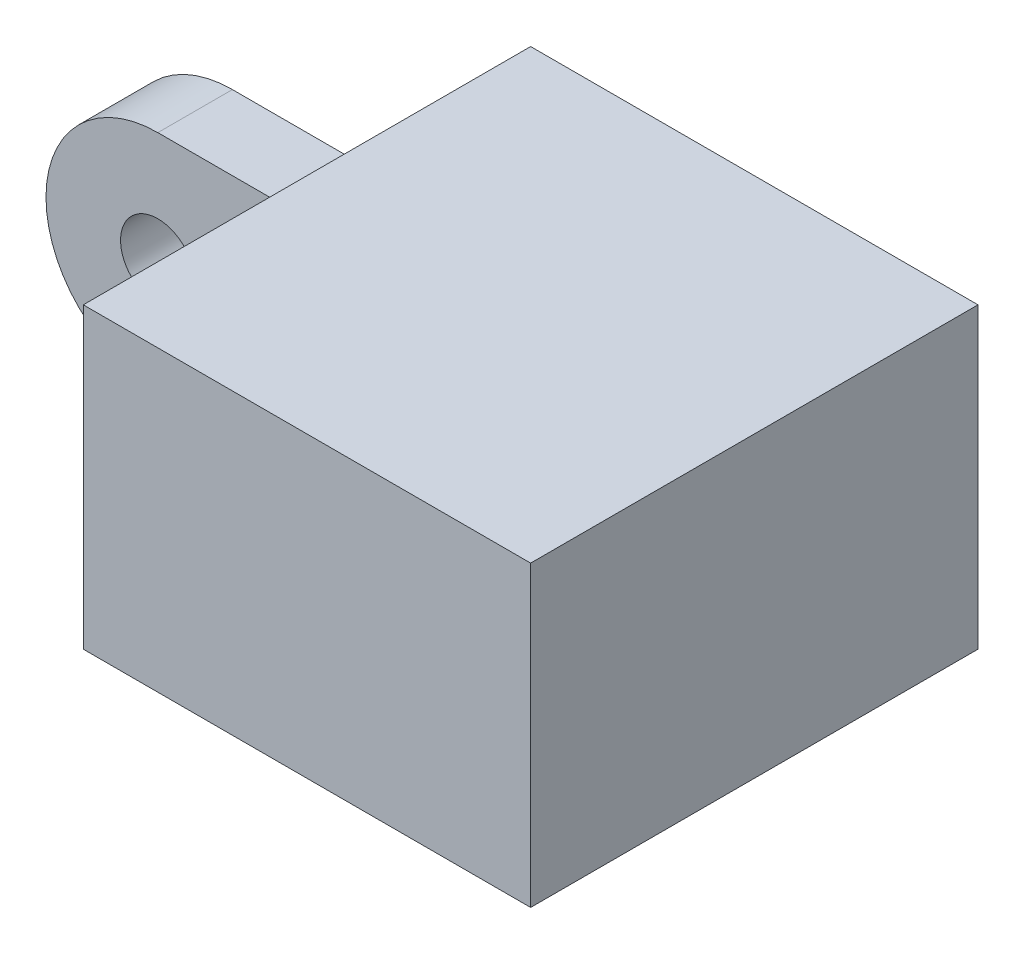
from build123d import *

# Parameters (mm, degrees)
SKETCH1_R           = 5
BOSS_EXTRUDE1_DEPTH = 10
SKETCH2_W           = 60
SKETCH2_H           = 40
BOSS_EXTRUDE2_DEPTH = 30
SKETCH3_W           = 60
SKETCH3_H           = 40
BOSS_EXTRUDE3_DEPTH = 20


with BuildPart() as part:
    # Sketch1 → Boss-Extrude1 (new body)
    with BuildSketch(Plane.XY):
        with BuildLine():
            Line((-30, -15), (-30, -20))
            Line((-30, -20), (30, -20))
            Line((30, -20), (30, 20))
            Line((30, 20), (-30, 20))
            Line((-30, 20), (-30, 15))
            Line((-30, 15), (-50, 15))
            ThreePointArc((-50, 15), (-65, 0), (-50, -15))
            Line((-50, -15), (-30, -15))
        make_face()
        with Locations((-50, 0)):
            Circle(SKETCH1_R, mode=Mode.SUBTRACT)
    extrude(amount=BOSS_EXTRUDE1_DEPTH)

    # Sketch2 → Boss-Extrude2 (add)
    with BuildSketch(Plane.XY.offset(10)):
        Rectangle(SKETCH2_W, SKETCH2_H)
    extrude(amount=BOSS_EXTRUDE2_DEPTH)

    # Sketch3 → Boss-Extrude3 (add)
    with BuildSketch(Plane(origin=(0, 0, 0), x_dir=(-1, 0, 0), z_dir=(0, 0, -1))):
        Rectangle(SKETCH3_W, SKETCH3_H)
    extrude(amount=BOSS_EXTRUDE3_DEPTH)


solid = part.part
